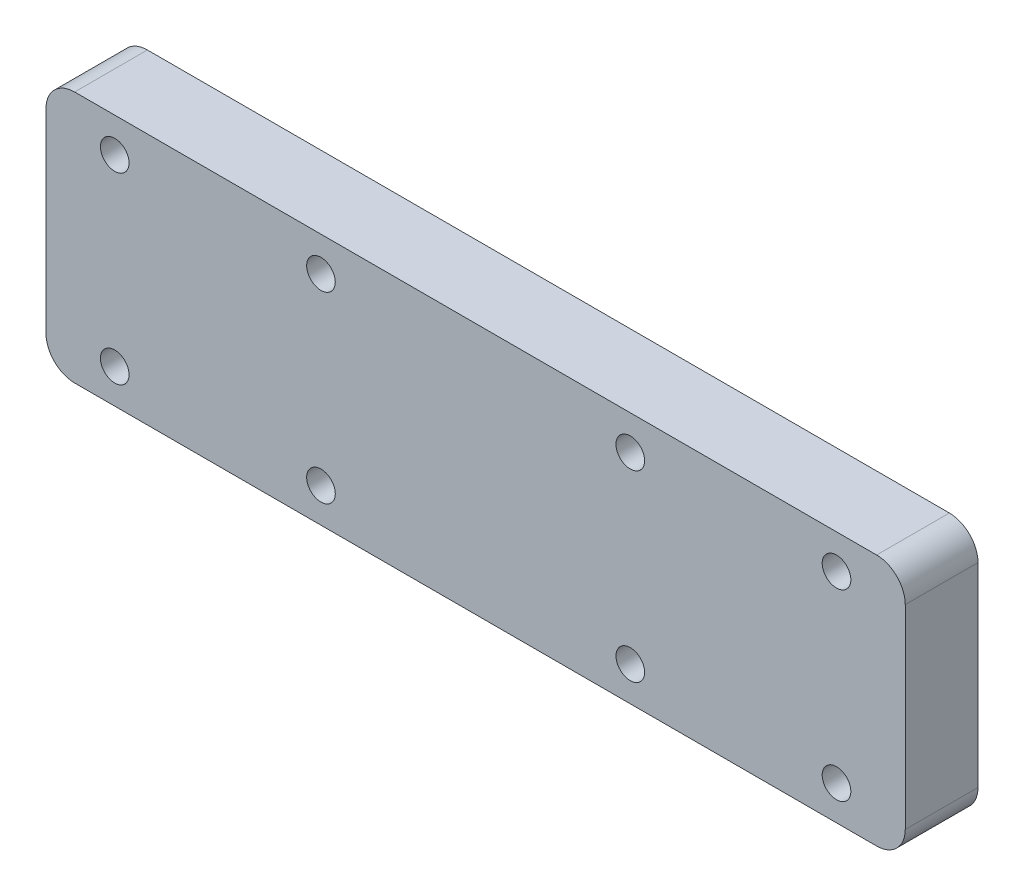
from build123d import *

# Parameters (mm, degrees)
SKETCH1_W           = 150
SKETCH1_H           = 44
SKETCH1_R           = 2.5
BOSS_EXTRUDE1_DEPTH = 12.7
FILLET1_R           = 5
SKETCH7_W           = 26
SKETCH7_H           = 22
SKETCH7_W_2         = 44
CUT_EXTRUDE2_DEPTH  = 9.7
FILLET3_R           = 5


with BuildPart() as part:
    # Sketch1 → Boss-Extrude1 (new body)
    with BuildSketch(Plane.XY):
        Rectangle(SKETCH1_W, SKETCH1_H)
        with Locations((-63, -16)):
            Circle(SKETCH1_R, mode=Mode.SUBTRACT)
        with Locations((-63, 16)):
            Circle(SKETCH1_R, mode=Mode.SUBTRACT)
        with Locations((-27, -16)):
            Circle(SKETCH1_R, mode=Mode.SUBTRACT)
        with Locations((-27, 16)):
            Circle(SKETCH1_R, mode=Mode.SUBTRACT)
        with Locations((27, -16)):
            Circle(SKETCH1_R, mode=Mode.SUBTRACT)
        with Locations((27, 16)):
            Circle(SKETCH1_R, mode=Mode.SUBTRACT)
        with Locations((63, -16)):
            Circle(SKETCH1_R, mode=Mode.SUBTRACT)
        with Locations((63, 16)):
            Circle(SKETCH1_R, mode=Mode.SUBTRACT)
    extrude(amount=BOSS_EXTRUDE1_DEPTH)

    # Fillet1
    fillet1_edges = [part.edges().sort_by_distance(p)[0] for p in [
        (75, -22, 6.35),
        (-75, -22, 6.35),
        (-75, 22, 6.35),
        (75, 22, 6.35),
    ]]
    fillet(fillet1_edges, radius=FILLET1_R)

    # Sketch7 → Cut-Extrude2 (cut)
    with BuildSketch(Plane(origin=(0, 0, 0), x_dir=(-1, 0, 0), z_dir=(0, 0, -1))):
        with Locations((-45, 0)):
            Rectangle(SKETCH7_W, SKETCH7_H)
        Rectangle(SKETCH7_W_2, SKETCH7_H)
        with Locations((45, 0)):
            Rectangle(SKETCH7_W, SKETCH7_H)
    extrude(amount=-CUT_EXTRUDE2_DEPTH, mode=Mode.SUBTRACT)

    # Fillet3
    fillet3_edges = [part.edges().sort_by_distance(p)[0] for p in [
        (58, -11, 4.85),
        (58, 11, 4.85),
        (32, 11, 4.85),
        (32, -11, 4.85),
        (22, -11, 4.85),
        (22, 11, 4.85),
        (-22, 11, 4.85),
        (-22, -11, 4.85),
        (-32, -11, 4.85),
        (-32, 11, 4.85),
        (-58, 11, 4.85),
        (-58, -11, 4.85),
    ]]
    fillet(fillet3_edges, radius=FILLET3_R)


solid = part.part
